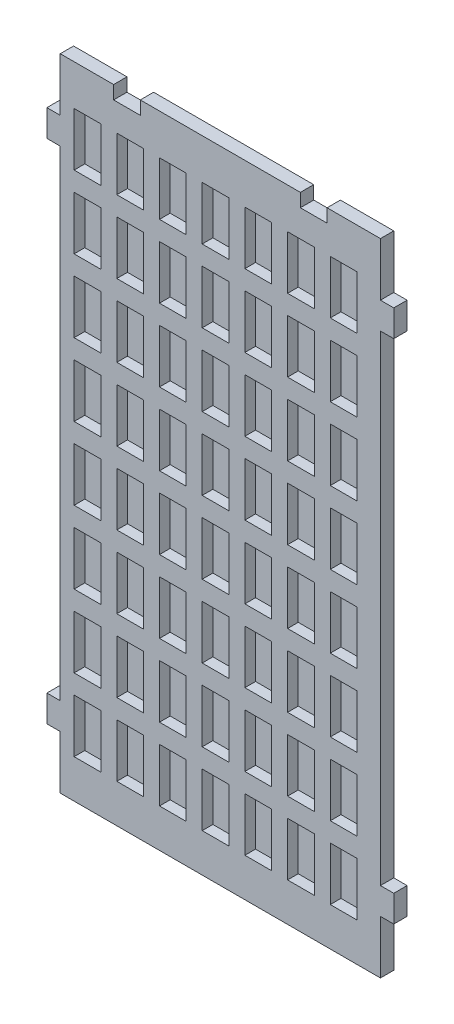
from build123d import *

# Parameters (mm, degrees)
BOSS_EXTRUDE1_DEPTH  = 3.175
SKETCH2_W            = 6.35
SKETCH2_H            = 12.7
CUT_EXTRUDE1_DEPTH   = 2.54
LPATTERN1_COUNT      = 7
LPATTERN1_PITCH      = 10.16
LPATTERN1_COUNT_DIR2 = 8
LPATTERN1_PITCH_DIR2 = 17.272


with BuildPart() as part:
    # Sketch1 → Boss-Extrude1 (new body)
    with BuildSketch(Plane.XY):
        Polygon((57.15, 0), (19.05, 0), (19.05, -3.175), (12.7, -3.175), (12.7, 0), (0, 0), (0, -12.7), (-3.175, -12.7), (-3.175, -19.05), (0, -19.05), (0, -133.35), (-3.175, -133.35), (-3.175, -139.7), (0, -139.7), (0, -152.4), (12.7, -152.4), (63.5, -152.4), (76.2, -152.4), (76.2, -139.7), (79.375, -139.7), (79.375, -133.35), (76.2, -133.35), (76.2, -19.05), (79.375, -19.05), (79.375, -12.7), (76.2, -12.7), (76.2, 0), (63.5, 0), (63.5, -3.175), (57.15, -3.175), align=None)
    extrude(amount=BOSS_EXTRUDE1_DEPTH)

    # Sketch2 → Cut-Extrude1 (cut)
    with BuildSketch(Plane.XY.offset(3.175)):
        with Locations((6.477, -15.981405818)):
            Rectangle(SKETCH2_W, SKETCH2_H)
    cut_extrude1 = extrude(amount=-CUT_EXTRUDE1_DEPTH, mode=Mode.SUBTRACT)

    # LPattern1: Cut-Extrude1 7 × 8
    with Locations(*[(i * LPATTERN1_PITCH, -j * LPATTERN1_PITCH_DIR2, 0) for i in range(LPATTERN1_COUNT) for j in range(LPATTERN1_COUNT_DIR2) if (i, j) != (0, 0)]):
        add(cut_extrude1, mode=Mode.SUBTRACT)


solid = part.part
